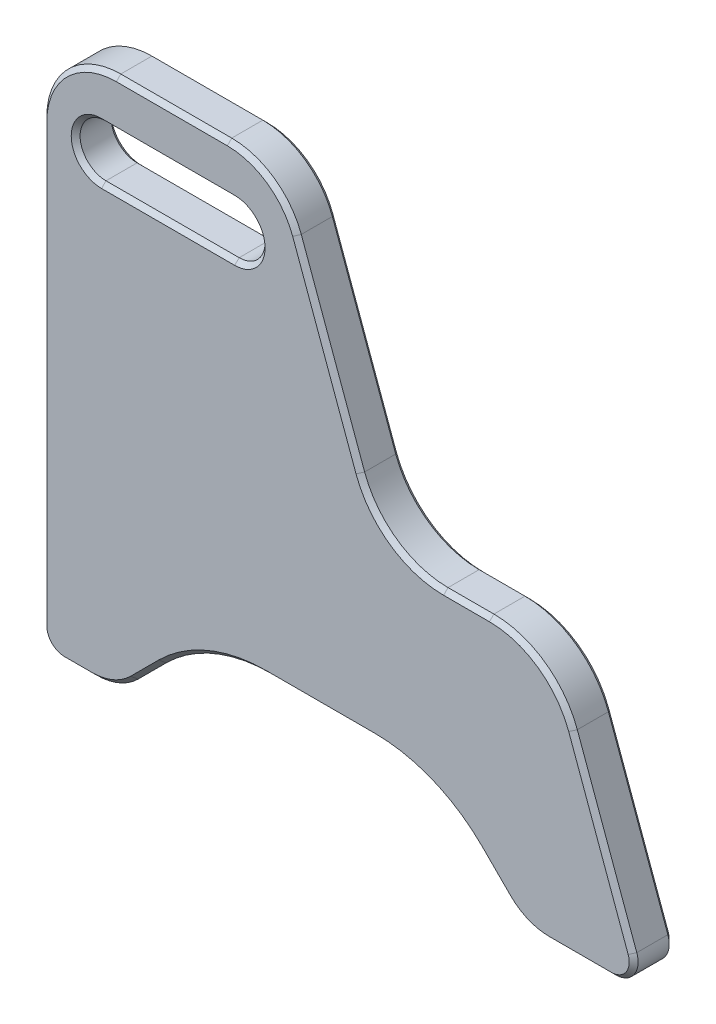
from build123d import *

# Parameters (mm, degrees)
BOSS_EXTRU_1_DEPTH           = 27
ENL_V_MAT_EXTRU_1_DEPTH      = 544.312782602
ENL_V_MAT_EXTRU_1_DEPTH_BACK = 544.312782602
CONG_3_R                     = 60
CONG_4_R                     = 50
CONG_5_R                     = 100
CONG_6_R                     = 15
CONG_7_R                     = 40
ENL_V_MAT_EXTRU_2_DEPTH      = 539.530227365
ENL_V_MAT_EXTRU_2_DEPTH_BACK = 539.530227365
CHANFREIN1_SIZE              = 3


with BuildPart() as part:
    # Esquisse1 → Boss.-Extru.1 (new body)
    with BuildSketch(Plane.XY):
        Polygon((0, 0), (0, 360), (160, 360), (229.154344511, 170), (344.154344511, 170), (406.029284336, 0), align=None)
    extrude(amount=BOSS_EXTRU_1_DEPTH)

    # Esquisse2 → Enlèv. mat.-Extru.1 (cut, two sides: drawn at the far end of the back side and taken through both)
    with BuildSketch(Plane.XY.offset(27).offset(-ENL_V_MAT_EXTRU_1_DEPTH_BACK)):
        Polygon((50, 0), (110, 60), (266.029284336, 60), (326.029284336, 0), align=None)
    extrude(amount=ENL_V_MAT_EXTRU_1_DEPTH + ENL_V_MAT_EXTRU_1_DEPTH_BACK, mode=Mode.SUBTRACT)

    # Congé3
    cong_3_edges = [part.edges().sort_by_distance(p)[0] for p in [
        (229.154344511, 170, 13.5),
        (344.154344511, 170, 13.5),
    ]]
    fillet(cong_3_edges, radius=CONG_3_R)

    # Congé4
    cong_4_edges = [part.edges().sort_by_distance(p)[0] for p in [
        (0, 360, 13.5),
        (160, 360, 13.5),
    ]]
    fillet(cong_4_edges, radius=CONG_4_R)

    # Congé5
    cong_5_edges = [part.edges().sort_by_distance(p)[0] for p in [
        (110, 60, 13.5),
        (266.029284336, 60, 13.5),
    ]]
    fillet(cong_5_edges, radius=CONG_5_R)

    # Congé6
    cong_6_edges = [part.edges().sort_by_distance(p)[0] for p in [
        (0, 0, 13.5),
        (406.029284336, 0, 13.5),
    ]]
    fillet(cong_6_edges, radius=CONG_6_R)

    # Congé7
    cong_7_edges = [part.edges().sort_by_distance(p)[0] for p in [
        (326.029284336, 0, 13.5),
        (50, 0, 13.5),
    ]]
    fillet(cong_7_edges, radius=CONG_7_R)

    # Esquisse3 → Enlèv. mat.-Extru.2 (cut, two sides: drawn at the far end of the back side and taken through both)
    with BuildSketch(Plane.XY.offset(27).offset(-ENL_V_MAT_EXTRU_2_DEPTH_BACK)):
        with BuildLine():
            Line((40, 327.5), (130, 327.5))
            ThreePointArc((130, 327.5), (147.5, 310), (130, 292.5))
            Line((130, 292.5), (40, 292.5))
            ThreePointArc((40, 292.5), (22.5, 310), (40, 327.5))
        make_face()
    extrude(amount=ENL_V_MAT_EXTRU_2_DEPTH + ENL_V_MAT_EXTRU_2_DEPTH_BACK, mode=Mode.SUBTRACT)

    # Chanfrein1
    chanfrein1_edges = [part.edges().sort_by_distance(p)[0] for p in [
        (22.5, 310, 0),
        (85, 327.5, 0),
        (147.5, 310, 0),
        (85, 292.5, 0),
        (22.5, 310, 27),
        (85, 292.5, 27),
        (147.5, 310, 27),
        (85, 327.5, 27),
        (286.654344511, 170, 0),
        (286.654344511, 170, 27),
        (193.379746842, 268.289899283, 0),
        (336.556478399, 159.149122657, 0),
        (193.379746842, 268.289899283, 27),
        (336.556478399, 159.149122657, 27),
        (236.752210622, 180.850877343, 0),
        (236.752210622, 180.850877343, 27),
        (0, 162.5, 0),
        (0, 162.5, 27),
        (87.494811545, 360, 0),
        (153.668444907, 350.957602214, 0),
        (14.644660941, 345.355339059, 0),
        (87.494811545, 360, 27),
        (153.668444907, 350.957602214, 27),
        (14.644660941, 345.355339059, 27),
        (188.014642168, 60, 0),
        (188.014642168, 60, 27),
        (304.8160809, 21.213203436, 27),
        (71.213203436, 21.213203436, 0),
        (262.876271335, 52.387953251, 27),
        (262.876271335, 52.387953251, 0),
        (113.153013001, 52.387953251, 27),
        (113.153013001, 52.387953251, 0),
        (24.215728753, 0, 0),
        (24.215728753, 0, 27),
        (378.612951506, 75.325755375, 0),
        (396.894344899, 6.396353455, 0),
        (4.393398282, 4.393398282, 0),
        (378.612951506, 75.325755375, 27),
        (396.894344899, 6.396353455, 27),
        (4.393398282, 4.393398282, 27),
        (304.8160809, 21.213203436, 0),
        (71.213203436, 21.213203436, 27),
        (363.602445533, 0, 27),
        (48.7387948, 3.0448187, 27),
        (327.290489536, 3.0448187, 27),
        (363.602445533, 0, 0),
        (48.7387948, 3.0448187, 0),
        (327.290489536, 3.0448187, 0),
    ]]
    chamfer(chanfrein1_edges, length=CHANFREIN1_SIZE)


solid = part.part
